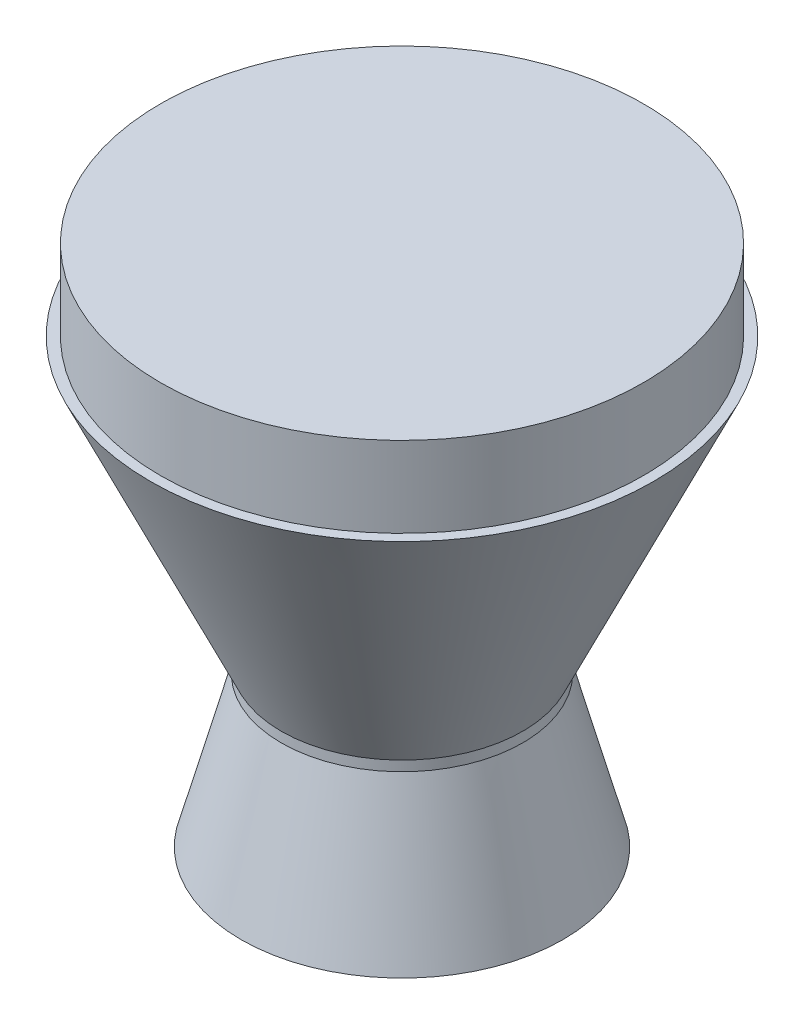
from build123d import *

# Parameters (mm, degrees)
SHELL1_T = -3.175


with BuildPart() as part:
    # Sketch1 → Revolve1 (revolve)
    with BuildSketch(Plane(origin=(0, 0, 0), x_dir=(0, 0, -1), z_dir=(1, 0, 0)), mode=Mode.PRIVATE) as revolve1_sk:
        Polygon((0, 0), (0, -164.872045256), (50.8, -164.872045256), (38.1, -117.475), (38.1, -114.3), (79.375, -25.4), (76.2, -25.4), (76.2, 0), align=None)
    revolve(revolve1_sk.sketch.rotate(Axis((0, 0, 0), (0, -1, 0)), 180), axis=Axis((0, 0, 0), (0, -1, 0)))

    # Shell1
    shell1_openings = [part.faces().sort_by_distance(p)[0] for p in [
        (0, -164.872045256, 0),
    ]]
    offset(amount=SHELL1_T, openings=shell1_openings, kind=Kind.INTERSECTION)


solid = part.part
